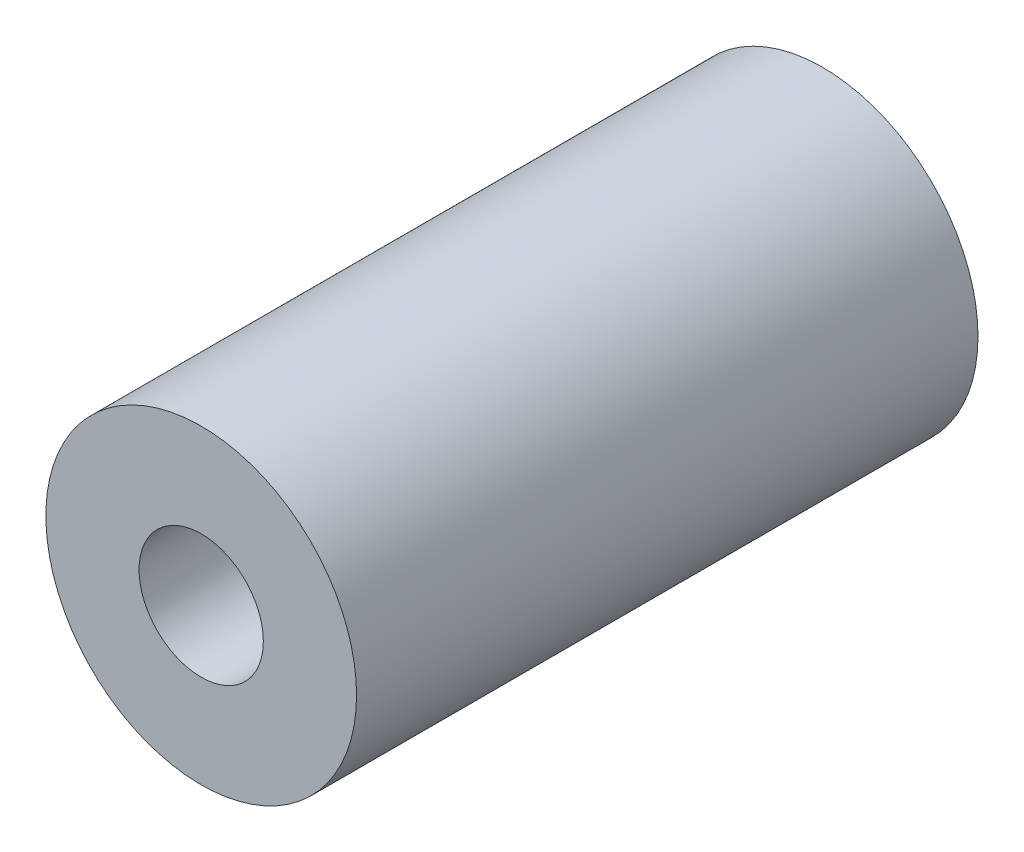
from build123d import *

# Parameters (mm, degrees)
SKETCH_1_R      = 5
SKETCH_1_R_2    = 2
EXTRUDE_1_DEPTH = 20


with BuildPart() as part:
    # 草图1 → 凸台-拉伸1 (new body)
    with BuildSketch(Plane.XY):
        Circle(SKETCH_1_R)
        Circle(SKETCH_1_R_2, mode=Mode.SUBTRACT)
    extrude(amount=EXTRUDE_1_DEPTH)


solid = part.part
